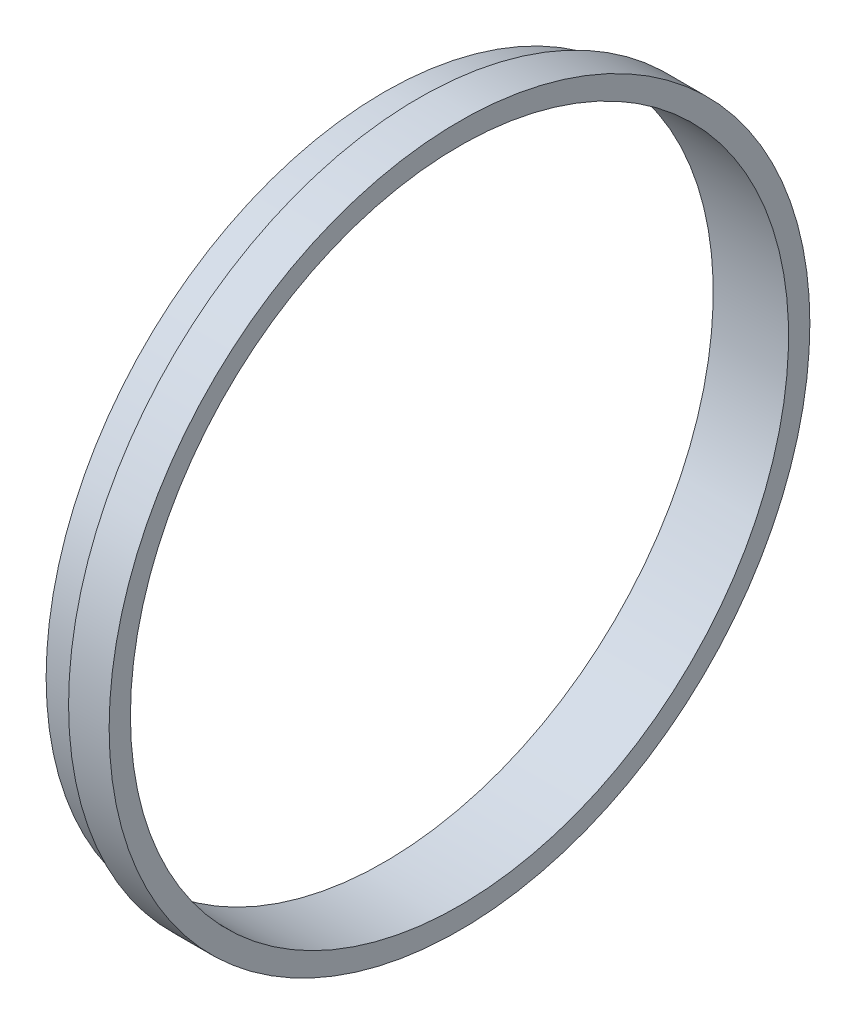
from build123d import *


with BuildPart() as part:
    # Sketch2 → Revolve1 (revolve)
    with BuildSketch(Plane.XY, mode=Mode.PRIVATE) as revolve1_sk:
        Polygon((0, 145.226985009), (33.25, 145.226985009), (33.25, 154.626985009), (15.35, 154.626985009), (15.35, 151.901985009), (20.15, 151.901985009), (20.15, 149.176985009), (0, 149.176985009), align=None)
    revolve(revolve1_sk.sketch.rotate(Axis((-72.365, 0, 0), (1, 0, 0)), 90), axis=Axis((-72.365, 0, 0), (1, 0, 0)))


solid = part.part
